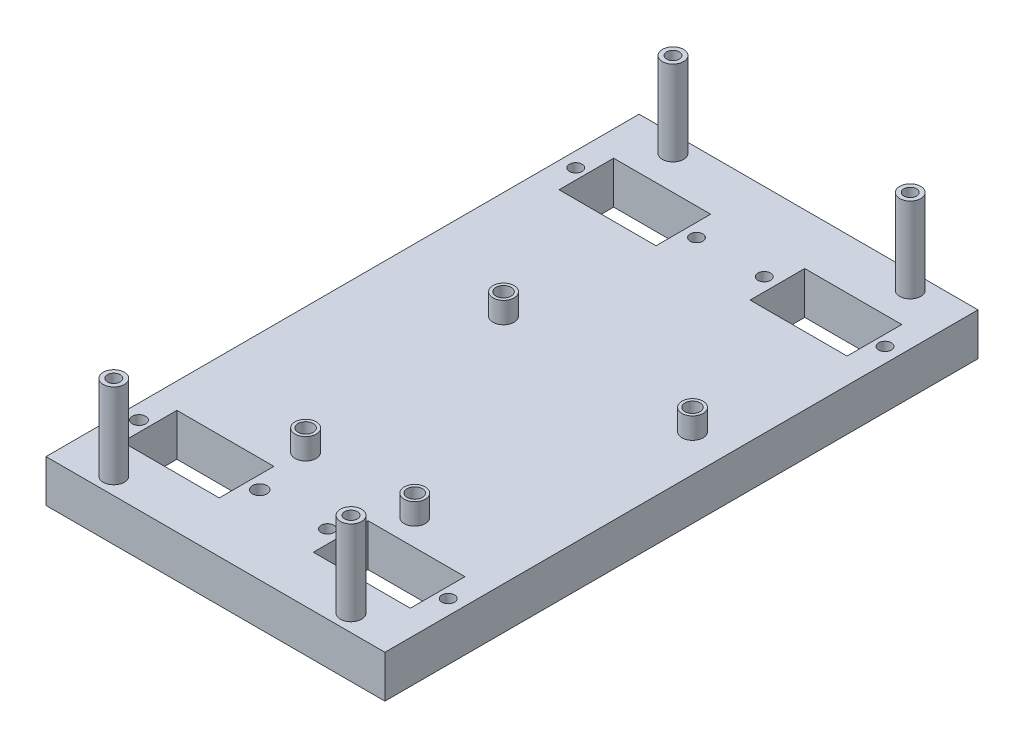
from build123d import *

# Parameters (mm, degrees)
SKETCH1_W           = 80
SKETCH1_H           = 140
BOSS_EXTRUDE1_DEPTH = 10
SKETCH4_W           = 22.9
SKETCH4_H           = 12.9
CUT_EXTRUDE2_DEPTH  = 162.554944214
SKETCH6_R           = 1.5
CUT_EXTRUDE4_DEPTH  = 162.554944214
SKETCH9_W           = 22.9
SKETCH9_H           = 12.9
CUT_EXTRUDE5_DEPTH  = 162.554944214
SKETCH13_R          = 2.5
BOSS_EXTRUDE2_DEPTH = 20
SKETCH14_R          = 1.5
CUT_EXTRUDE8_DEPTH  = 5
SKETCH15_R          = 2.5
BOSS_EXTRUDE3_DEPTH = 20
SKETCH16_R          = 1.5
CUT_EXTRUDE9_DEPTH  = 5
SKETCH17_R          = 1.567331153
SKETCH17_R_2        = 1.710433461
CUT_EXTRUDE10_DEPTH = 163.480768093
SKETCH24_R          = 2.5
BOSS_EXTRUDE5_DEPTH = 5
SKETCH26_R          = 1.8
CUT_EXTRUDE11_DEPTH = 5


with BuildPart() as part:
    # Sketch1 → Boss-Extrude1 (new body)
    with BuildSketch(Plane(origin=(0, 0, 0), x_dir=(1, 0, 0), z_dir=(0, 1, 0))):
        with Locations((-40, 70)):
            Rectangle(SKETCH1_W, SKETCH1_H)
    extrude(amount=BOSS_EXTRUDE1_DEPTH)

    # Sketch4 → Cut-Extrude2 (cut, through all)
    with BuildSketch(Plane(origin=(0, 10, 0), x_dir=(1, 0, 0), z_dir=(0, 1, 0))):
        with Locations((-17.45, 121.55)):
            Rectangle(SKETCH4_W, SKETCH4_H)
    cut_extrude2 = extrude(amount=-CUT_EXTRUDE2_DEPTH, mode=Mode.SUBTRACT)

    # Sketch6 → Cut-Extrude4 (cut, through all)
    with BuildSketch(Plane(origin=(0, 10, 0), x_dir=(1, 0, 0), z_dir=(0, 1, 0))):
        with Locations(Location((-3.5, 121.55, 0), (0, 0, 270))):
            Circle(SKETCH6_R)
        with Locations(Location((-32, 121.55, 0), (0, 0, 270))):
            Circle(SKETCH6_R)
    cut_extrude4 = extrude(amount=-CUT_EXTRUDE4_DEPTH, mode=Mode.SUBTRACT)

    # Mirror4: Cut-Extrude2, Cut-Extrude4 across plane
    add(cut_extrude2.mirror(Plane.XY.offset(-70)), mode=Mode.SUBTRACT)
    add(cut_extrude4.mirror(Plane.XY.offset(-70)), mode=Mode.SUBTRACT)

    # Mirror15: Cut-Extrude2, Cut-Extrude4 across plane
    add(cut_extrude2.mirror(Plane.ZY.offset(40)), mode=Mode.SUBTRACT)
    add(cut_extrude4.mirror(Plane.ZY.offset(40)), mode=Mode.SUBTRACT)

    # Sketch9 → Cut-Extrude5 (cut, through all)
    with BuildSketch(Plane(origin=(0, 10, 0), x_dir=(1, 0, 0), z_dir=(0, 1, 0))):
        with Locations((-62.55, 18.45)):
            Rectangle(SKETCH9_W, SKETCH9_H)
    extrude(amount=-CUT_EXTRUDE5_DEPTH, mode=Mode.SUBTRACT)

    # Sketch13 → Boss-Extrude2 (add)
    with BuildSketch(Plane(origin=(0, 10, 0), x_dir=(1, 0, 0), z_dir=(0, 1, 0))):
        with Locations(Location((-68, 136, 0), (0, 0, 270))):
            Circle(SKETCH13_R)
    boss_extrude2 = extrude(amount=BOSS_EXTRUDE2_DEPTH)

    # Sketch14 → Cut-Extrude8 (cut)
    with BuildSketch(Plane(origin=(0, 30, 0), x_dir=(1, 0, 0), z_dir=(0, 1, 0))):
        with Locations(Location((-68, 136, 0), (0, 0, 270))):
            Circle(SKETCH14_R)
    cut_extrude8 = extrude(amount=-CUT_EXTRUDE8_DEPTH, mode=Mode.SUBTRACT)

    # Sketch15 → Boss-Extrude3 (add)
    with BuildSketch(Plane(origin=(0, 10, 0), x_dir=(1, 0, 0), z_dir=(0, 1, 0))):
        with Locations(Location((-12, 136, 0), (0, 0, 270))):
            Circle(SKETCH15_R)
    boss_extrude3 = extrude(amount=BOSS_EXTRUDE3_DEPTH)

    # Sketch16 → Cut-Extrude9 (cut)
    with BuildSketch(Plane(origin=(0, 30, 0), x_dir=(1, 0, 0), z_dir=(0, 1, 0))):
        with Locations(Location((-12, 136, 0), (0, 0, 270))):
            Circle(SKETCH16_R)
    cut_extrude9 = extrude(amount=-CUT_EXTRUDE9_DEPTH, mode=Mode.SUBTRACT)

    # Mirror22: Boss-Extrude2, Cut-Extrude8, Boss-Extrude3, Cut-Extrude9 across plane
    add(boss_extrude2.mirror(Plane.XY.offset(-70)))
    add(cut_extrude8.mirror(Plane.XY.offset(-70)), mode=Mode.SUBTRACT)
    add(boss_extrude3.mirror(Plane.XY.offset(-70)))
    add(cut_extrude9.mirror(Plane.XY.offset(-70)), mode=Mode.SUBTRACT)

    # Sketch17 → Cut-Extrude10 (cut, through all)
    with BuildSketch(Plane(origin=(0, 10, 0), x_dir=(1, 0, 0), z_dir=(0, 1, 0))):
        with Locations(Location((-76.5, 18.45, 0), (0, 0, 270))):
            Circle(SKETCH17_R)
        with Locations(Location((-48, 18.45, 0), (0, 0, 270))):
            Circle(SKETCH17_R_2)
    extrude(amount=-CUT_EXTRUDE10_DEPTH, mode=Mode.SUBTRACT)

    # Sketch24 → Boss-Extrude5 (add)
    with BuildSketch(Plane(origin=(0, 10, 0), x_dir=(1, 0, 0), z_dir=(0, 1, 0))):
        with Locations(Location((-54.703909306, 82.704708795, 0), (0, 0, 270))):
            Circle(SKETCH24_R)
        with Locations(Location((-8.776377109, 81.387548885, 0), (0, 0, 270))):
            Circle(SKETCH24_R)
        with Locations(Location((-24.025346163, 31.067743918, 0), (0, 0, 270))):
            Circle(SKETCH24_R)
        with Locations(Location((-50.214312923, 31.502322072, 0), (0, 0, 270))):
            Circle(SKETCH24_R)
    extrude(amount=BOSS_EXTRUDE5_DEPTH)

    # Sketch26 → Cut-Extrude11 (cut)
    with BuildSketch(Plane(origin=(0, 15, 0), x_dir=(1, 0, 0), z_dir=(0, 1, 0))):
        with Locations(Location((-54.703909306, 82.704708795, 0), (0, 0, 270))):
            Circle(SKETCH26_R)
        with Locations(Location((-8.776377109, 81.387548885, 0), (0, 0, 270))):
            Circle(SKETCH26_R)
        with Locations(Location((-24.025346163, 31.067743918, 0), (0, 0, 270))):
            Circle(SKETCH26_R)
        with Locations(Location((-50.214312923, 31.502322072, 0), (0, 0, 270))):
            Circle(SKETCH26_R)
    extrude(amount=-CUT_EXTRUDE11_DEPTH, mode=Mode.SUBTRACT)


solid = part.part
